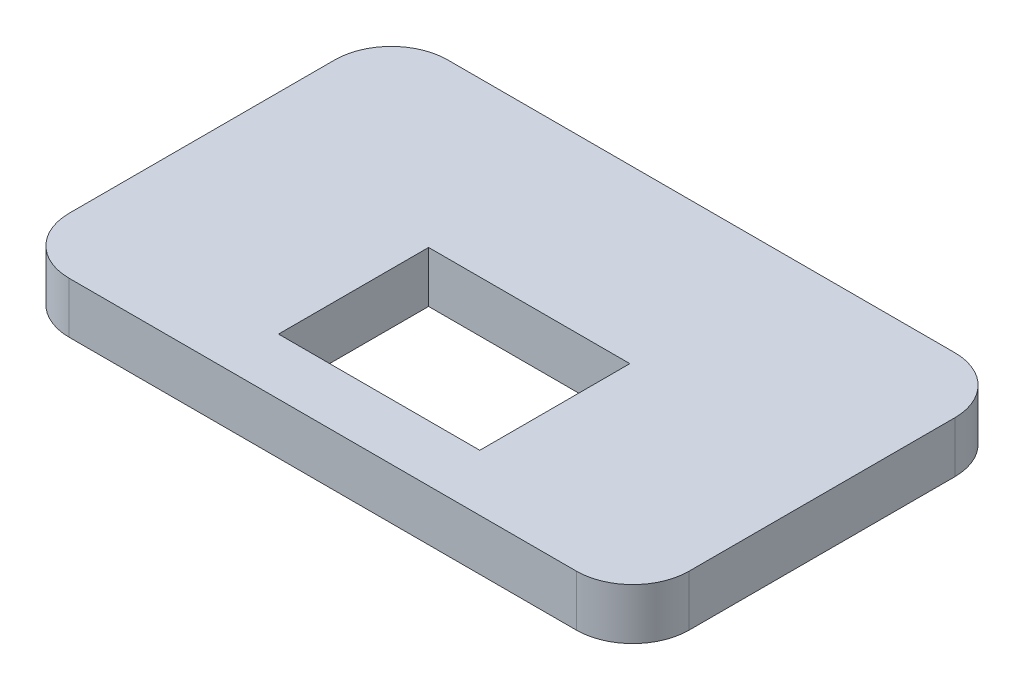
from build123d import *

# Parameters (mm, degrees)
BOSS_EXTRUDE1_DEPTH = 6.35
SKETCH2_W           = 25
SKETCH2_H           = 18.64
CUT_EXTRUDE1_DEPTH  = 91.434078201


with BuildPart() as part:
    # Sketch1 → Boss-Extrude1 (new body)
    with BuildSketch(Plane(origin=(0, 0, 0), x_dir=(1, 0, 0), z_dir=(0, 1, 0))):
        with BuildLine():
            Line((7, 0), (70, 0))
            ThreePointArc((70, 0), (74.949747468, 2.050252532), (77, 7))
            Line((77, 7), (77, 40))
            ThreePointArc((77, 40), (74.949747468, 44.949747468), (70, 47))
            Line((70, 47), (7, 47))
            ThreePointArc((7, 47), (2.050252532, 44.949747468), (0, 40))
            Line((0, 40), (0, 7))
            ThreePointArc((0, 7), (2.050252532, 2.050252532), (7, 0))
        make_face()
    extrude(amount=BOSS_EXTRUDE1_DEPTH)

    # Sketch2 → Cut-Extrude1 (cut, through all)
    with BuildSketch(Plane(origin=(0, 6.35, 0), x_dir=(1, 0, 0), z_dir=(0, 1, 0))):
        with Locations((38.5, 16.32)):
            Rectangle(SKETCH2_W, SKETCH2_H)
    extrude(amount=-CUT_EXTRUDE1_DEPTH, mode=Mode.SUBTRACT)


solid = part.part
